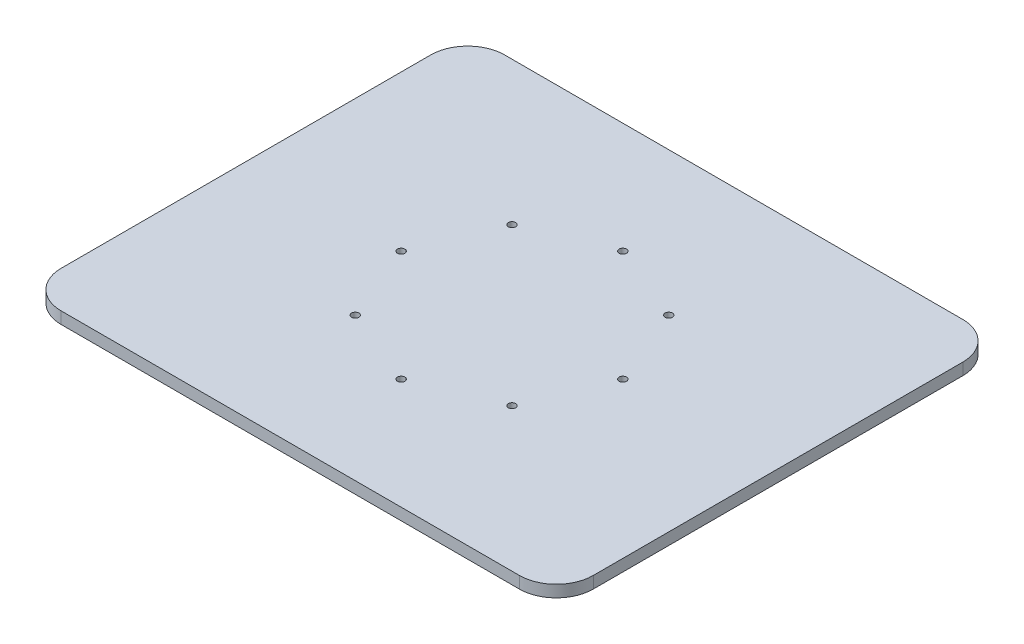
from build123d import *

# Parameters (mm, degrees)
SKETCH_1_W                   = 720
SKETCH_1_H                   = 600
EXTRUDE_1_DEPTH              = 16
HOLE_WIZARD_M5_1_D           = 5.5
HOLE_WIZARD_M5_1_CBORE_D     = 10
HOLE_WIZARD_M5_1_CBORE_DEPTH = 12
FILLET_1_R                   = 50


with BuildPart() as part:
    # 草图1 → 凸台-拉伸1 (new body)
    with BuildSketch(Plane(origin=(0, 16, 0), x_dir=(1, 0, 0), z_dir=(0, 1, 0))):
        Rectangle(SKETCH_1_W, SKETCH_1_H)
    extrude(amount=-EXTRUDE_1_DEPTH)

    # M5 六角头螺栓的柱形沉头孔1 (through all)
    with Locations(Plane(origin=(0, 16, 0), x_dir=(1, 0, 0), z_dir=(0, 1, 0))):
        with Locations((106.066017178, -106.066017178), (0, -150), (-106.066017178, -106.066017178), (-150, 0), (-106.066017178, 106.066017178), (0, 150), (106.066017178, 106.066017178), (150, 0)):
            CounterBoreHole(HOLE_WIZARD_M5_1_D / 2, HOLE_WIZARD_M5_1_CBORE_D / 2, HOLE_WIZARD_M5_1_CBORE_DEPTH)

    # 圆角1
    fillet_1_edges = [part.edges().sort_by_distance(p)[0] for p in [
        (-360, 8, -300),
        (360, 8, -300),
        (360, 8, 300),
        (-360, 8, 300),
    ]]
    fillet(fillet_1_edges, radius=FILLET_1_R)


solid = part.part
